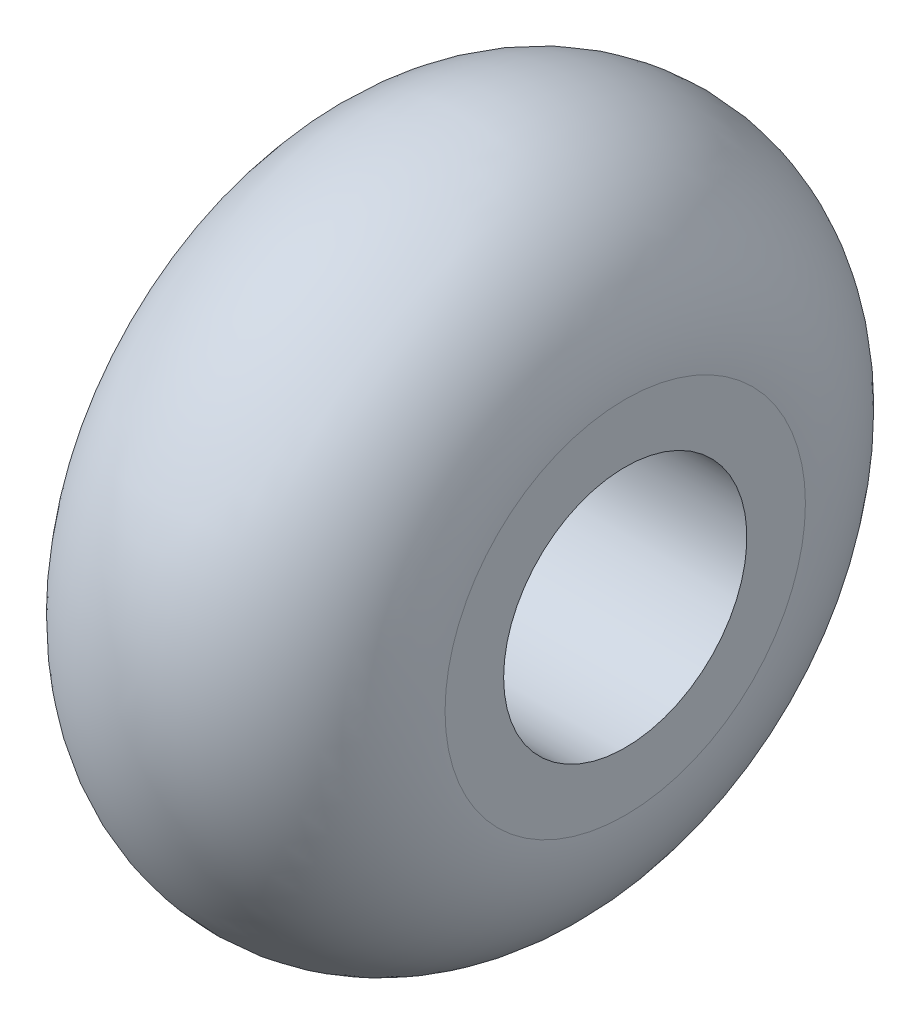
from build123d import *


with BuildPart() as part:
    # Sketch1 → Revolve1 (revolve)
    with BuildSketch(Plane.XY, mode=Mode.PRIVATE) as revolve1_sk:
        with BuildLine():
            Line((0, 4.05), (11, 4.05))
            Line((11, 4.05), (11, 6))
            ThreePointArc((11, 6), (5.5, 11.5), (0, 6))
            Line((0, 6), (0, 4.05))
        make_face()
    revolve(revolve1_sk.sketch.rotate(Axis((0, 0, 0), (1, 0, 0)), 90), axis=Axis((0, 0, 0), (1, 0, 0)))


solid = part.part
